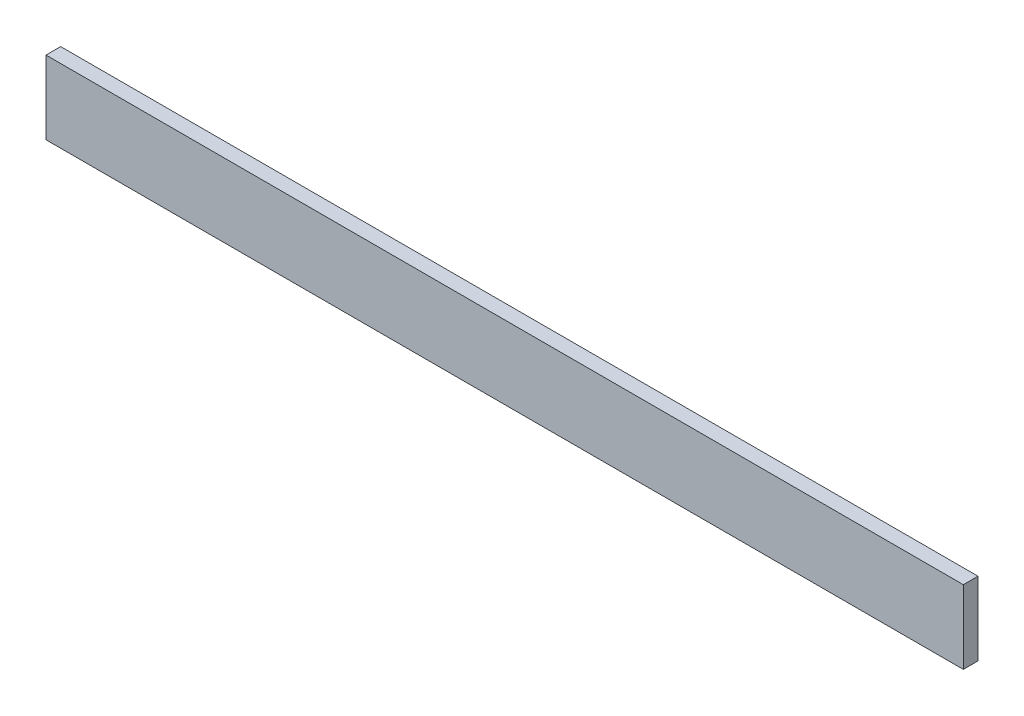
from build123d import *

# Parameters (mm, degrees)
ESQUISSE1_W        = 500
ESQUISSE1_H        = 40
BOSS_EXTRU_1_DEPTH = 8


with BuildPart() as part:
    # Esquisse1 → Boss.-Extru.1 (new body)
    with BuildSketch(Plane.XY):
        with Locations((250, 20)):
            Rectangle(ESQUISSE1_W, ESQUISSE1_H)
    extrude(amount=BOSS_EXTRU_1_DEPTH)


solid = part.part
